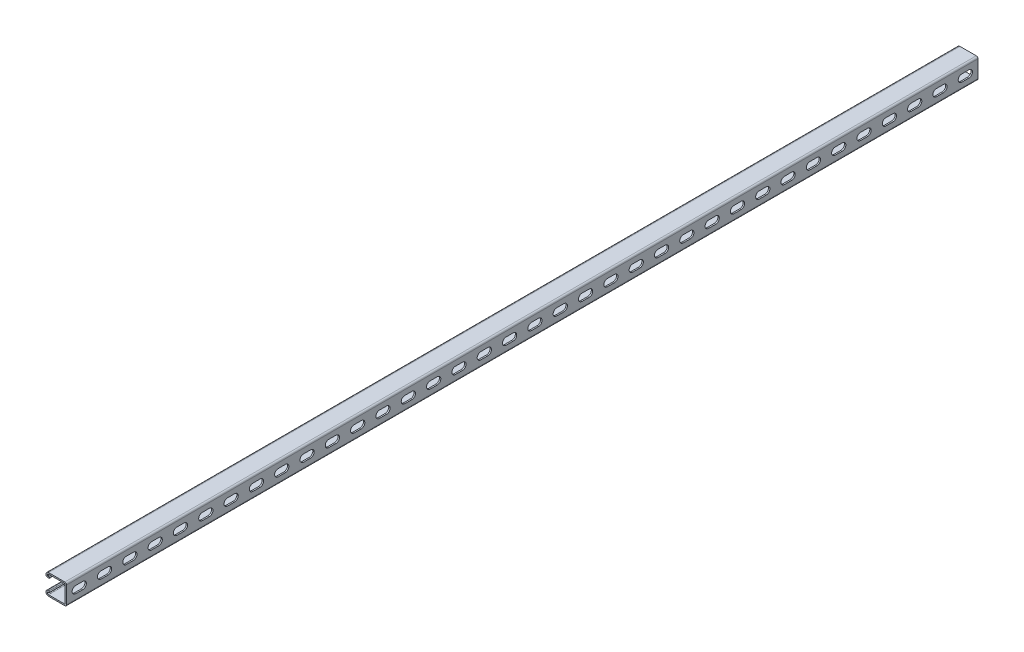
from build123d import *

# Parameters (mm, degrees)
BOSS_EXTRUDE1_DEPTH = 1828.8
CUT_EXTRUDE1_DEPTH  = 2.794
LPATTERN1_COUNT     = 36
LPATTERN1_PITCH     = 50.8


with BuildPart() as part:
    # Sketch1 → Boss-Extrude1 (new body)
    with BuildSketch(Plane.XY):
        with BuildLine():
            Line((-36.22675, 20.6375), (-3.46075, 20.6375))
            ThreePointArc((-3.46075, 20.6375), (-1.013630207, 19.623869793), (0, 17.17675))
            Line((0, 17.17675), (0, -17.17675))
            ThreePointArc((0, -17.17675), (-1.013630207, -19.623869793), (-3.46075, -20.6375))
            Line((-3.46075, -20.6375), (-36.22675, -20.6375))
            ThreePointArc((-36.22675, -20.6375), (-39.796401808, -19.158901808), (-41.275, -15.58925))
            Line((-41.275, -15.58925), (-41.275, -14.57325))
            ThreePointArc((-41.275, -14.57325), (-40.261369793, -12.126130207), (-37.81425, -11.1125))
            Line((-37.81425, -11.1125), (-35.5346, -11.1125))
            ThreePointArc((-35.5346, -11.1125), (-34.1376, -12.5095), (-35.5346, -13.9065))
            Line((-35.5346, -13.9065), (-37.81425, -13.9065))
            ThreePointArc((-37.81425, -13.9065), (-38.285713446, -14.101786554), (-38.481, -14.57325))
            Line((-38.481, -14.57325), (-38.481, -15.58925))
            ThreePointArc((-38.481, -15.58925), (-37.820745461, -17.183245461), (-36.22675, -17.8435))
            Line((-36.22675, -17.8435), (-3.46075, -17.8435))
            ThreePointArc((-3.46075, -17.8435), (-2.989286554, -17.648213446), (-2.794, -17.17675))
            Line((-2.794, -17.17675), (-2.794, 17.17675))
            ThreePointArc((-2.794, 17.17675), (-2.989286554, 17.648213446), (-3.46075, 17.8435))
            Line((-3.46075, 17.8435), (-36.22675, 17.8435))
            ThreePointArc((-36.22675, 17.8435), (-37.820745461, 17.183245461), (-38.481, 15.58925))
            Line((-38.481, 15.58925), (-38.481, 14.57325))
            ThreePointArc((-38.481, 14.57325), (-38.285713446, 14.101786554), (-37.81425, 13.9065))
            Line((-37.81425, 13.9065), (-35.5346, 13.9065))
            ThreePointArc((-35.5346, 13.9065), (-34.1376, 12.5095), (-35.5346, 11.1125))
            Line((-35.5346, 11.1125), (-37.81425, 11.1125))
            ThreePointArc((-37.81425, 11.1125), (-40.261369793, 12.126130207), (-41.275, 14.57325))
            Line((-41.275, 14.57325), (-41.275, 15.58925))
            ThreePointArc((-41.275, 15.58925), (-39.796401808, 19.158901808), (-36.22675, 20.6375))
        make_face()
    extrude(amount=-BOSS_EXTRUDE1_DEPTH)

    # Sketch2 → Cut-Extrude1 (cut)
    with BuildSketch(Plane(origin=(0, 0, 0), x_dir=(0, 0, -1), z_dir=(1, 0, 0))):
        with BuildLine():
            Line((18.25625, 7.14375), (32.54375, 7.14375))
            ThreePointArc((32.54375, 7.14375), (39.6875, 0), (32.54375, -7.14375))
            Line((32.54375, -7.14375), (18.25625, -7.14375))
            ThreePointArc((18.25625, -7.14375), (11.1125, 0), (18.25625, 7.14375))
        make_face()
    cut_extrude1 = extrude(amount=-CUT_EXTRUDE1_DEPTH, mode=Mode.SUBTRACT)

    # LPattern1: Cut-Extrude1 ×36
    with Locations(*[(0, 0, -i * LPATTERN1_PITCH) for i in range(1, LPATTERN1_COUNT)]):
        add(cut_extrude1, mode=Mode.SUBTRACT)


solid = part.part
